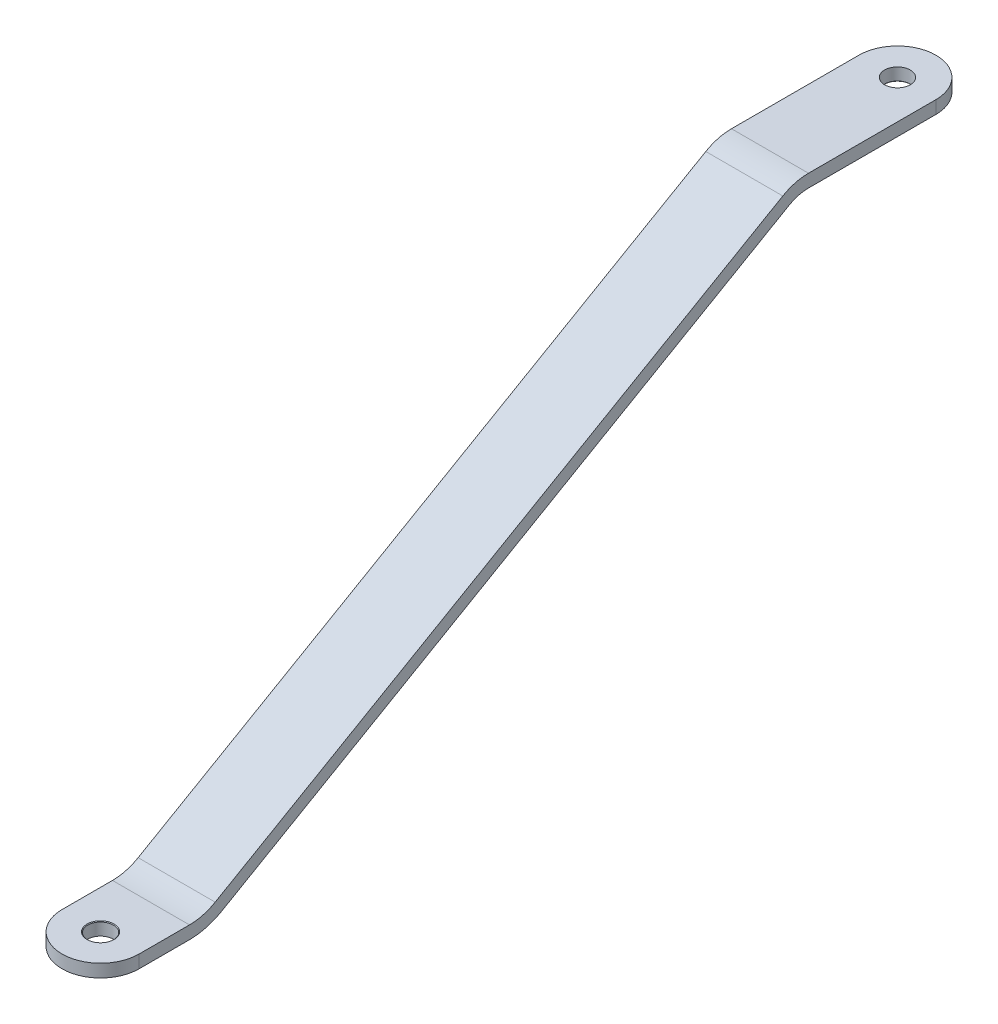
from build123d import *

# Parameters (mm, degrees)
BOSS_EXTRUDE1_DEPTH = 76.2
FILLET1_RADIUS      = 38.1
FILLET1_LENGTH      = 12.7
FILLET2_RADIUS      = 38.1
FILLET2_LENGTH      = 12.7


with BuildPart() as part:
    # Sketch2 → Boss-Extrude1 (new body)
    with BuildSketch(Plane(origin=(0, 0, 0), x_dir=(0, 0, -1), z_dir=(1, 0, 0))):
        with BuildLine():
            Line((-394.160701906, 0), (-306.172520882, 0))
            ThreePointArc((-306.172520882, 0), (-293.024513391, 1.730968025), (-280.772520882, 6.805909488))
            Line((-280.772520882, 6.805909488), (280.772520882, 331.014090512))
            ThreePointArc((280.772520882, 331.014090512), (293.024513391, 336.089031975), (306.172520882, 337.82))
            Line((306.172520882, 337.82), (470.360701906, 337.82))
            Line((470.360701906, 337.82), (470.360701906, 325.12))
            Line((470.360701906, 325.12), (306.172520882, 325.12))
            ThreePointArc((306.172520882, 325.12), (296.311515264, 323.821773982), (287.122520882, 320.015567884))
            Line((287.122520882, 320.015567884), (-274.422520882, -4.19261314))
            ThreePointArc((-274.422520882, -4.19261314), (-289.737511518, -10.536289969), (-306.172520882, -12.7))
            Line((-306.172520882, -12.7), (-394.160701906, -12.7))
            Line((-394.160701906, -12.7), (-394.160701906, 0))
        make_face()
    extrude(amount=BOSS_EXTRUDE1_DEPTH)

    # Fillet1: full round fillet: the end face becomes a half cylinder, R = half its width
    fillet1_face = Plane((38.1, -6.35, 394.160701906), x_dir=(0, -1, 0), z_dir=(0, 0, 1))  # on the end face: x along it, z out of the body
    fillet1_slab = fillet1_face.offset(-FILLET1_RADIUS / 2) * Box(FILLET1_LENGTH, 2 * FILLET1_RADIUS, FILLET1_RADIUS, mode=Mode.PRIVATE)  # the body's end, R deep
    fillet1_round = Plane((38.1, -6.35, 356.060701906), x_dir=(0, 0, 1), z_dir=(0, -1, 0)) * Cylinder(FILLET1_RADIUS, FILLET1_LENGTH, mode=Mode.PRIVATE)  # its axis R under the face
    add(fillet1_slab - fillet1_round, mode=Mode.SUBTRACT)

    # Fillet2: full round fillet: the end face becomes a half cylinder, R = half its width
    fillet2_face = Plane((38.1, 331.47, -470.360701906), x_dir=(0, 1, 0), z_dir=(0, 0, -1))  # on the end face: x along it, z out of the body
    fillet2_slab = fillet2_face.offset(-FILLET2_RADIUS / 2) * Box(FILLET2_LENGTH, 2 * FILLET2_RADIUS, FILLET2_RADIUS, mode=Mode.PRIVATE)  # the body's end, R deep
    fillet2_round = Plane((38.1, 331.47, -432.260701906), x_dir=(0, 0, -1), z_dir=(0, 1, 0)) * Cylinder(FILLET2_RADIUS, FILLET2_LENGTH, mode=Mode.PRIVATE)  # its axis R under the face
    add(fillet2_slab - fillet2_round, mode=Mode.SUBTRACT)

    # Sketch4 → 1 (1) Diameter Hole1 (revolve, cut)
    with BuildSketch(Plane(origin=(38.1, 0, 356.060701906), x_dir=(0, 0, 1), z_dir=(1, 0, 0))):
        Polygon((0, 0), (0, 12.7), (12.7, 12.7), (12.7, 0.635), (13.335, 0), align=None)
    revolve(axis=Axis((38.1, 6.35, 356.060701906), (0, -1, 0)), mode=Mode.SUBTRACT)

    # Sketch7 → 1 (1) Diameter Hole2 (revolve, cut)
    with BuildSketch(Plane(origin=(38.1, 325.12, -432.260701906), x_dir=(0, 0, -1), z_dir=(1, 0, 0))):
        Polygon((0, 0), (0, 12.7), (12.7, 12.7), (12.7, 0.635), (13.335, 0), align=None)
    revolve(axis=Axis((38.1, 318.77, -432.260701906), (0, 1, 0)), mode=Mode.SUBTRACT)


solid = part.part
